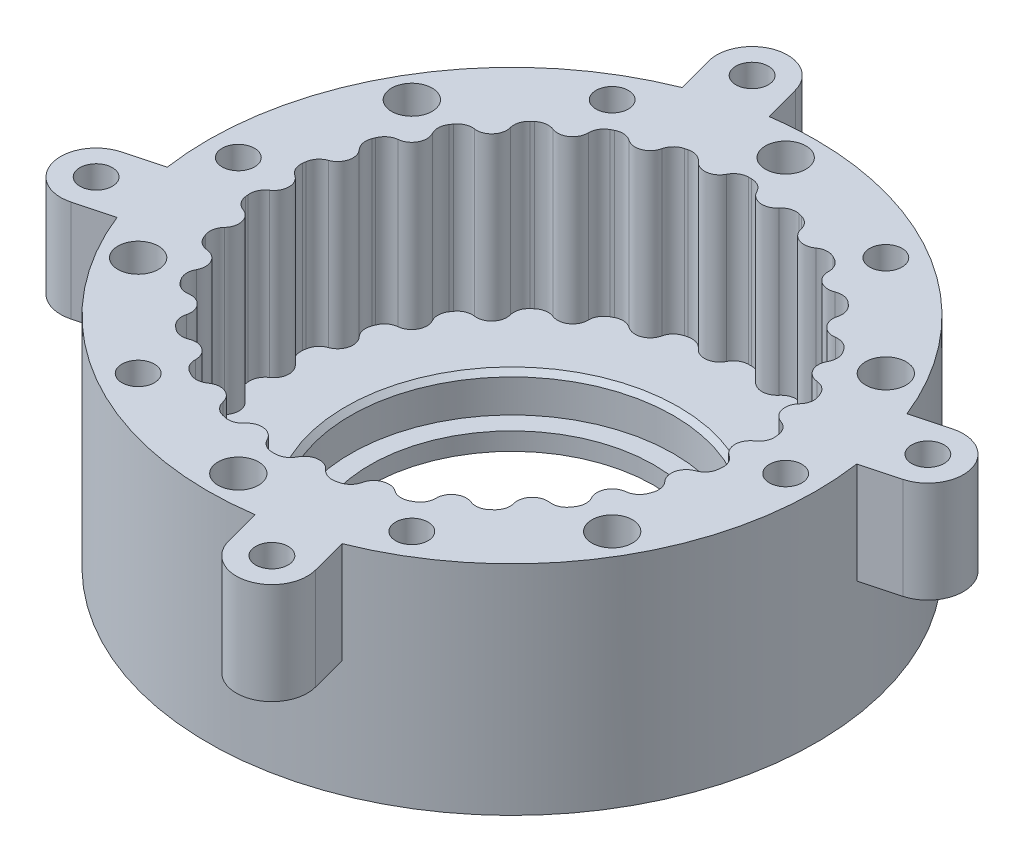
from build123d import *

# Parameters (mm, degrees)
SKETCH1_R                 = 30
SKETCH1_R_2               = 23.5
BOSS_EXTRUDE4_DEPTH       = 16
BOSS_EXTRUDE6_START       = 5.5
SKETCH7_R                 = 30
BOSS_EXTRUDE6_DEPTH       = 5.5
SKETCH8_R                 = 1.6
CUT_EXTRUDE4_DEPTH        = 21.5
CIRPATTERN19_COUNT        = 12
SKETCH9_R                 = 2
CUT_EXTRUDE5_DEPTH        = 4.5
CIRPATTERN21_COUNT        = 6
SKETCH10_R                = 2
CUT_EXTRUDE6_DEPTH        = 4.5
CIRPATTERN22_COUNT        = 6
SKETCH12_R                = 15.925
CUT_EXTRUDE8_DEPTH        = 3.75
SKETCH13_R                = 14
CUT_EXTRUDE9_DEPTH        = 1.75
CHAMFER1_SIZE             = 0.5
SKETCH15_R                = 1.5
BOSS_EXTRUDE9_DEPTH       = 16
FILLET2_R                 = 1.5
CIRPATTERN28_COUNT        = 26
FILLET2_OF_CIRPATTERN28_R = 1.5
SKETCH16_R                = 1.6
BOSS_EXTRUDE10_DEPTH      = 10
CIRPATTERN29_COUNT        = 4


with BuildPart() as part:
    # Sketch1 → Boss-Extrude4 (new body)
    with BuildSketch(Plane(origin=(0, 0, 0), x_dir=(1, 0, 0), z_dir=(0, 1, 0))):
        with Locations(Location((0, 0, 0), (0, 0, 270))):
            Circle(SKETCH1_R)
        with Locations(Location((0, 0, 0), (0, 0, 270))):
            Circle(SKETCH1_R_2, mode=Mode.SUBTRACT)
    extrude(amount=BOSS_EXTRUDE4_DEPTH)

    # Sketch7 → Boss-Extrude6 (add)
    with BuildSketch(Plane.XZ.offset(BOSS_EXTRUDE6_START)):
        with Locations(Location((0, 0, 0), (0, 0, 270))):
            Circle(SKETCH7_R)
    extrude(amount=-BOSS_EXTRUDE6_DEPTH)

    # Sketch8 → Cut-Extrude4 (cut)
    with BuildSketch(Plane(origin=(0, 16, 0), x_dir=(1, 0, 0), z_dir=(0, 1, 0))):
        with Locations(Location((-27, 0, 0), (0, 0, 270))):
            Circle(SKETCH8_R)
    cut_extrude4 = extrude(amount=-CUT_EXTRUDE4_DEPTH, mode=Mode.SUBTRACT)

    # CirPattern19: Cut-Extrude4 ×12 about axis
    cirpattern19_axis = Axis((0, 0, 0), (0, 1, 0))
    for i in range(1, CIRPATTERN19_COUNT):
        add(cut_extrude4.rotate(cirpattern19_axis, i * 360 / CIRPATTERN19_COUNT), mode=Mode.SUBTRACT)

    # Sketch9 → Cut-Extrude5 (cut)
    with BuildSketch(Plane.XZ.offset(5.5)):
        with Locations(Location((-27, 0, 0), (0, 0, 270))):
            Circle(SKETCH9_R)
    cut_extrude5 = extrude(amount=-CUT_EXTRUDE5_DEPTH, mode=Mode.SUBTRACT)

    # CirPattern21: Cut-Extrude5 ×6 about axis
    cirpattern21_axis = Axis((0, 0, 0), (0, 1, 0))
    for i in range(1, CIRPATTERN21_COUNT):
        add(cut_extrude5.rotate(cirpattern21_axis, i * 360 / CIRPATTERN21_COUNT), mode=Mode.SUBTRACT)

    # Sketch10 → Cut-Extrude6 (cut)
    with BuildSketch(Plane(origin=(0, 16, 0), x_dir=(1, 0, 0), z_dir=(0, 1, 0))):
        with Locations(Location((23.382685902, 13.5, 0), (0, 0, 270))):
            Circle(SKETCH10_R)
    cut_extrude6 = extrude(amount=-CUT_EXTRUDE6_DEPTH, mode=Mode.SUBTRACT)

    # CirPattern22: Cut-Extrude6 ×6 about axis
    cirpattern22_axis = Axis((0, 0, 0), (0, 1, 0))
    for i in range(1, CIRPATTERN22_COUNT):
        add(cut_extrude6.rotate(cirpattern22_axis, i * 360 / CIRPATTERN22_COUNT), mode=Mode.SUBTRACT)

    # Sketch12 → Cut-Extrude8 (cut)
    with BuildSketch(Plane(origin=(0, 0, 0), x_dir=(1, 0, 0), z_dir=(0, 1, 0))):
        with Locations(Location((0, 0, 0), (0, 0, 270))):
            Circle(SKETCH12_R)
    extrude(amount=-CUT_EXTRUDE8_DEPTH, mode=Mode.SUBTRACT)

    # Sketch13 → Cut-Extrude9 (cut)
    with BuildSketch(Plane(origin=(0, -3.75, 0), x_dir=(1, 0, 0), z_dir=(0, 1, 0))):
        with Locations(Location((0, 0, 0), (0, 0, 270))):
            Circle(SKETCH13_R)
    extrude(amount=-CUT_EXTRUDE9_DEPTH, mode=Mode.SUBTRACT)

    # Chamfer1
    chamfer1_edges = [part.edges().sort_by_distance(p)[0] for p in [
        (0, 0, -15.925),
    ]]
    chamfer(chamfer1_edges, length=CHAMFER1_SIZE)

    # Sketch15 → Boss-Extrude9 (add)
    with BuildSketch(Plane(origin=(0, 16, 0), x_dir=(1, 0, 0), z_dir=(0, 1, 0))):
        with Locations((-23.5, 0)):
            Circle(SKETCH15_R)
    boss_extrude9 = extrude(amount=-BOSS_EXTRUDE9_DEPTH)

    # Fillet2
    fillet2_edges = [part.edges().sort_by_distance(p)[0] for p in [
        (-23.45212766, 8, -1.499235885),
        (-23.45212766, 8, 1.499235885),
    ]]
    fillet(fillet2_edges, radius=FILLET2_R)

    # CirPattern28: Boss-Extrude9 ×26 about axis
    cirpattern28_axis = Axis((0, 0, 0), (0, 1, 0))
    for i in range(1, CIRPATTERN28_COUNT):
        add(boss_extrude9.rotate(cirpattern28_axis, i * 360 / CIRPATTERN28_COUNT))

    # Fillet2 of CirPattern28
    fillet2_of_cirpattern28_edges = [part.edges().sort_by_distance(p)[0] for p in [
        (-23.129442084, 8, 4.156790695),
        (-22.411860821, 8, 7.068132325),
        (-21.462557407, 8, 9.571239709),
        (-20.069098094, 8, 12.226254605),
        (-18.548346906, 8, 14.429443061),
        (-16.559992335, 8, 16.673831409),
        (-14.556173904, 8, 18.449059631),
        (-12.088480015, 8, 20.152385738),
        (-9.718048984, 8, 21.396483916),
        (-6.914429175, 8, 22.459756659),
        (-4.31514638, 8, 23.100422328),
        (-1.338536846, 8, 23.461848161),
        (1.338536846, 8, 23.461848161),
        (4.31514638, 8, 23.100422328),
        (6.914429175, 8, 22.459756659),
        (9.718048984, 8, 21.396483916),
        (12.088480015, 8, 20.152385738),
        (14.556173904, 8, 18.449059631),
        (16.559992335, 8, 16.673831409),
        (18.548346906, 8, 14.429443061),
        (20.069098094, 8, 12.226254605),
        (21.462557407, 8, 9.571239709),
        (22.411860821, 8, 7.068132325),
        (23.129442084, 8, 4.156790695),
        (23.45212766, 8, 1.499235885),
        (23.45212766, 8, -1.499235885),
        (23.129442084, 8, -4.156790695),
        (22.411860821, 8, -7.068132325),
        (21.462557407, 8, -9.571239709),
        (20.069098094, 8, -12.226254605),
        (18.548346906, 8, -14.429443061),
        (16.559992335, 8, -16.673831409),
        (14.556173904, 8, -18.449059631),
        (12.088480015, 8, -20.152385738),
        (9.718048984, 8, -21.396483916),
        (6.914429175, 8, -22.459756659),
        (4.31514638, 8, -23.100422328),
        (1.338536846, 8, -23.461848161),
        (-1.338536846, 8, -23.461848161),
        (-4.31514638, 8, -23.100422328),
        (-6.914429175, 8, -22.459756659),
        (-9.718048984, 8, -21.396483916),
        (-12.088480015, 8, -20.152385738),
        (-14.556173904, 8, -18.449059631),
        (-16.559992335, 8, -16.673831409),
        (-18.548346906, 8, -14.429443061),
        (-20.069098094, 8, -12.226254605),
        (-21.462557407, 8, -9.571239709),
        (-22.411860821, 8, -7.068132325),
        (-23.129442084, 8, -4.156790695),
    ]]
    fillet(fillet2_of_cirpattern28_edges, radius=FILLET2_OF_CIRPATTERN28_R)

    # Sketch16 → Boss-Extrude10 (add)
    with BuildSketch(Plane(origin=(0, 16, 0), x_dir=(1, 0, 0), z_dir=(0, 1, 0))):
        with BuildLine():
            Line((-12.051178403, 31.452648523), (-10.673443553, 26.310872064))
            Line((-10.673443553, 26.310872064), (-3.911962769, 28.12260538))
            Line((-3.911962769, 28.12260538), (-5.289697619, 33.264381839))
            ThreePointArc((-5.289697619, 33.264381839), (-9.576304669, 35.739255573), (-12.051178403, 31.452648523))
        make_face()
        with Locations(Location((-8.670438011, 32.358515181, 0), (0, 0, 270))):
            Circle(SKETCH16_R, mode=Mode.SUBTRACT)
    boss_extrude10 = extrude(amount=-BOSS_EXTRUDE10_DEPTH)

    # CirPattern29: Boss-Extrude10 ×4 about axis
    cirpattern29_axis = Axis((0, 0, 0), (0, 1, 0))
    for i in range(1, CIRPATTERN29_COUNT):
        add(boss_extrude10.rotate(cirpattern29_axis, i * 360 / CIRPATTERN29_COUNT))


solid = part.part
